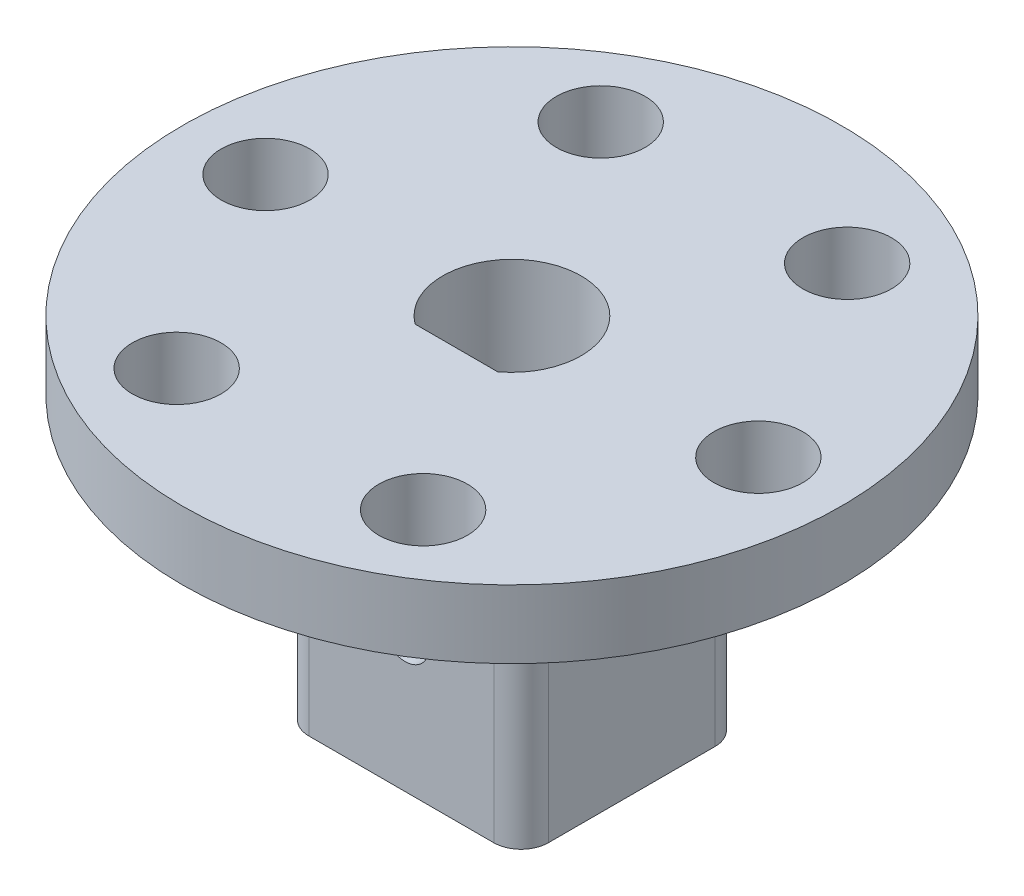
from build123d import *

# Parameters (mm, degrees)
SKETCH_1_W                      = 30
SKETCH_1_H                      = 30
SKETCH_1_W_2                    = 21.5
SKETCH_1_H_2                    = 21.5
EXTRUDE_1_DEPTH                 = 5
SKETCH_2_W                      = 30
SKETCH_2_H                      = 30
EXTRUDE_2_DEPTH                 = 5
SKETCH_4_W                      = 17.554664
SKETCH_4_H                      = 16.21575
EXTRUDE_3_DEPTH                 = 11
SKETCH_5_R                      = 24.152219
SKETCH_5_R_2                    = 3.25
EXTRUDE_4_DEPTH                 = 5
CUT_EXTRUDE_2_DEPTH             = 21
FILLET_1_R                      = 2
SKETCH_10_W                     = 21.5
SKETCH_10_H                     = 21.5
EXTRUDE_5_DEPTH                 = 5
CUT_EXTRUDE_3_REACH             = 49.959
SKETCH_11_R                     = 1.75
CUT_EXTRUDE_3_DIRECTION_2_REACH = 49.959
SKETCH_12_R                     = 24.152219
CUT_EXTRUDE_4_DEPTH             = 21
CUT_EXTRUDE_5_REACH             = 42.096


with BuildPart() as part:
    # 草图1 → 凸台-拉伸1 (new body)
    with BuildSketch(Plane(origin=(0, 0, 0), x_dir=(1, 0, 0), z_dir=(0, 1, 0))):
        Rectangle(SKETCH_1_W, SKETCH_1_H)
        Rectangle(SKETCH_1_W_2, SKETCH_1_H_2, mode=Mode.SUBTRACT)
    extrude(amount=EXTRUDE_1_DEPTH)

    # 草图2 → 凸台-拉伸2 (add)
    with BuildSketch(Plane(origin=(0, 5, 0), x_dir=(1, 0, 0), z_dir=(0, 1, 0))):
        Rectangle(SKETCH_2_W, SKETCH_2_H)
    extrude(amount=EXTRUDE_2_DEPTH)

    # 草图4 → 凸台-拉伸3 (add)
    with BuildSketch(Plane(origin=(0, 10, 0), x_dir=(1, 0, 0), z_dir=(0, 1, 0))):
        Rectangle(SKETCH_4_W, SKETCH_4_H)
    extrude(amount=EXTRUDE_3_DEPTH)

    # 草图5 → 凸台-拉伸4 (add)
    with BuildSketch(Plane(origin=(0, 21, 0), x_dir=(1, 0, 0), z_dir=(0, 1, 0))):
        with Locations(Location((0, 0, 0), (0, 0, 270))):
            Circle(SKETCH_5_R)
        with Locations(Location((8.9491, 15.617734, 0), (0, 0, 270))):
            Circle(SKETCH_5_R_2, mode=Mode.SUBTRACT)
        with Locations(Location((17.999904, 0.058719, 0), (0, 0, 270))):
            Circle(SKETCH_5_R_2, mode=Mode.SUBTRACT)
        with Locations(Location((9.050804, -15.559015, 0), (0, 0, 270))):
            Circle(SKETCH_5_R_2, mode=Mode.SUBTRACT)
        with Locations(Location((-8.9491, -15.617734, 0), (0, 0, 270))):
            Circle(SKETCH_5_R_2, mode=Mode.SUBTRACT)
        with Locations(Location((-17.999904, -0.058719, 0), (0, 0, 270))):
            Circle(SKETCH_5_R_2, mode=Mode.SUBTRACT)
        with Locations(Location((-9.050804, 15.559015, 0), (0, 0, 270))):
            Circle(SKETCH_5_R_2, mode=Mode.SUBTRACT)
    extrude(amount=EXTRUDE_4_DEPTH)

    # 草图6 → 切除-拉伸2 (cut)
    with BuildSketch(Plane.XZ.offset(-5)):
        with BuildLine():
            Line((-3.024897, 4.075), (3.024897, 4.075))
            ThreePointArc((3.024897, 4.075), (0, -5.075), (-3.024897, 4.075))
        make_face()
    extrude(amount=-CUT_EXTRUDE_2_DEPTH, mode=Mode.SUBTRACT)

    # 圆角1
    fillet_1_edges = [part.edges().sort_by_distance(p)[0] for p in [
        (-8.777332, 15.5, -8.107875),
        (-8.777332, 15.5, 8.107875),
        (8.777332, 15.5, 8.107875),
        (8.777332, 15.5, -8.107875),
        (15, 5, 15),
        (-15, 5, 15),
        (-15, 5, -15),
        (15, 5, -15),
    ]]
    fillet(fillet_1_edges, radius=FILLET_1_R)

    # 草图10 → 凸台-拉伸5 (add)
    with BuildSketch(Plane.XZ.offset(-5)):
        Rectangle(SKETCH_10_W, SKETCH_10_H)
    extrude(amount=EXTRUDE_5_DEPTH)

    # 切除-拉伸3: up to this face of the body (flat: up to its plane)
    cut_extrude_3_end = Plane(part.part.faces().sort_by_distance((0, 5, -15))[0])
    # 草图11 → 切除-拉伸3 (cut, up to the picked face)
    with BuildSketch(Plane.XY.offset(8.107875), mode=Mode.PRIVATE) as cut_extrude_3_sk1:
        with Locations(Location((0.277648, 10, 0), (0, 0, 180))):
            Circle(SKETCH_11_R)
    cut_extrude_3_tool1 = split(extrude(cut_extrude_3_sk1.sketch, amount=-CUT_EXTRUDE_3_REACH, mode=Mode.PRIVATE), bisect_by=cut_extrude_3_end, keep=Keep.BOTH, mode=Mode.PRIVATE)
    add(cut_extrude_3_tool1.solids().sort_by(Axis((0.277648, 10, 8.107875), (0, 0, -1)))[0], mode=Mode.SUBTRACT)

    # 草图11 → 切除-拉伸3 direction 2 (cut, up to next)
    with BuildSketch(Plane.XY.offset(8.107875), mode=Mode.PRIVATE) as cut_extrude_3_direction_2_sk1:
        with Locations(Location((0.277648, 10, 0), (0, 0, 180))):
            Circle(SKETCH_11_R)
    cut_extrude_3_direction_2_tool1 = extrude(cut_extrude_3_direction_2_sk1.sketch, amount=CUT_EXTRUDE_3_DIRECTION_2_REACH, mode=Mode.PRIVATE) & part.part
    add(cut_extrude_3_direction_2_tool1.solids().sort_by_distance((0.277648, 10, 8.107875))[0], mode=Mode.SUBTRACT)

    # 草图12 → 切除-拉伸4 (cut)
    with BuildSketch(Plane.XZ.offset(-21)):
        with Locations(Location((0, 0, 0), (0, 0, 90))):
            Circle(SKETCH_12_R)
        with BuildLine():
            Line((-8.777332, -6.107875), (-8.777332, 6.107875))
            ThreePointArc((-8.777332, 6.107875), (-8.191546, 7.522088), (-6.777332, 8.107875))
            Line((-6.777332, 8.107875), (6.777332, 8.107875))
            ThreePointArc((6.777332, 8.107875), (8.191546, 7.522088), (8.777332, 6.107875))
            Line((8.777332, 6.107875), (8.777332, -6.107875))
            ThreePointArc((8.777332, -6.107875), (8.191546, -7.522088), (6.777332, -8.107875))
            Line((6.777332, -8.107875), (-6.777332, -8.107875))
            ThreePointArc((-6.777332, -8.107875), (-8.191546, -7.522088), (-8.777332, -6.107875))
        make_face(mode=Mode.SUBTRACT)
    extrude(amount=CUT_EXTRUDE_4_DEPTH, mode=Mode.SUBTRACT)

    # 草图13 → 切除-拉伸5 (cut, up to next)
    with BuildSketch(Plane(origin=(0, 5, 0), x_dir=(1, 0, 0), z_dir=(0, 1, 0)), mode=Mode.PRIVATE) as cut_extrude_5_sk1:
        with BuildLine():
            Line((-3.024897, -4.075), (3.024897, -4.075))
            ThreePointArc((3.024897, -4.075), (0, 5.075), (-3.024897, -4.075))
        make_face()
    cut_extrude_5_tool1 = extrude(cut_extrude_5_sk1.sketch, amount=-CUT_EXTRUDE_5_REACH, mode=Mode.PRIVATE) & part.part
    add(cut_extrude_5_tool1.solids().sort_by_distance((0, 5, -0.240279))[0], mode=Mode.SUBTRACT)


solid = part.part
